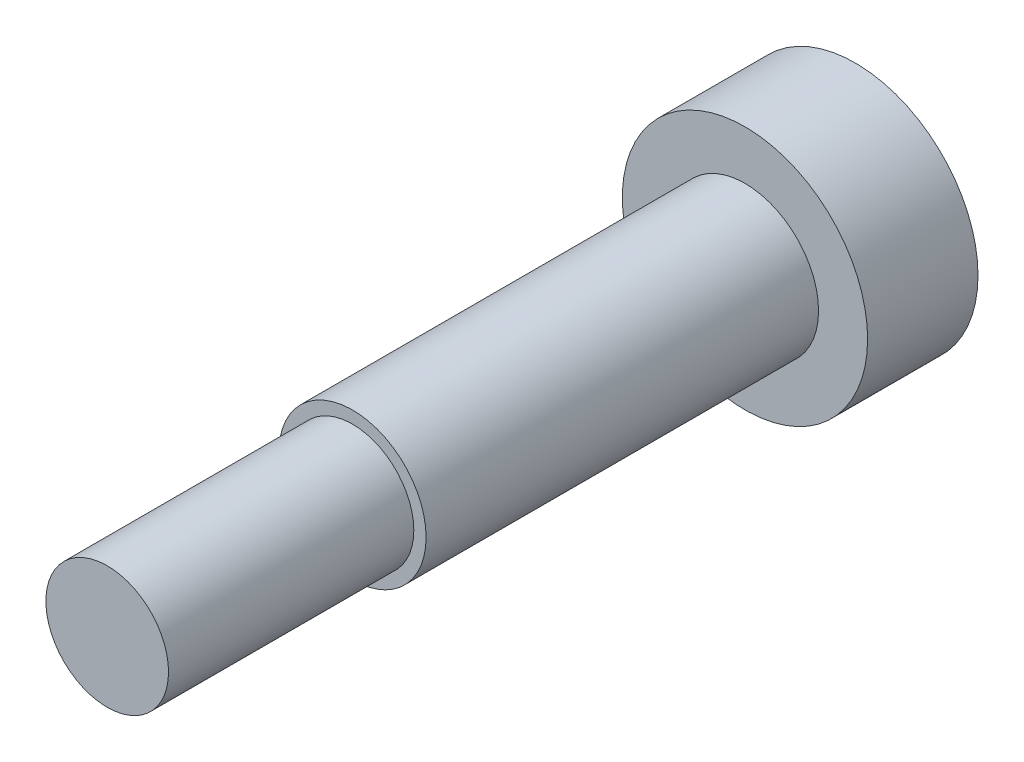
from build123d import *

# Parameters (mm, degrees)
SKETCH_1_R          = 5
EXTRUDE_1_DEPTH     = 4.5
CUT_EXTRUDE_1_DEPTH = 2
SKETCH_3_R          = 3
EXTRUDE_2_DEPTH     = 16
SKETCH_4_R          = 2.5
EXTRUDE_3_DEPTH     = 10


with BuildPart() as part:
    # 草图1 → 凸台-拉伸1 (new body)
    with BuildSketch(Plane.XY):
        Circle(SKETCH_1_R)
    extrude(amount=EXTRUDE_1_DEPTH)

    # 草图2 → 切除-拉伸1 (cut)
    with BuildSketch(Plane(origin=(0, 0, 0), x_dir=(-1, 0, 0), z_dir=(0, 0, -1))):
        Polygon((1.5, -0.866025404), (1.5, 0.866025404), (0, 1.732050808), (-1.5, 0.866025404), (-1.5, -0.866025404), (0, -1.732050808), align=None)
    extrude(amount=-CUT_EXTRUDE_1_DEPTH, mode=Mode.SUBTRACT)

    # 草图3 → 凸台-拉伸2 (add)
    with BuildSketch(Plane.XY.offset(4.5)):
        Circle(SKETCH_3_R)
    extrude(amount=EXTRUDE_2_DEPTH)

    # 草图4 → 凸台-拉伸3 (add)
    with BuildSketch(Plane.XY.offset(20.5)):
        Circle(SKETCH_4_R)
    extrude(amount=EXTRUDE_3_DEPTH)


solid = part.part
